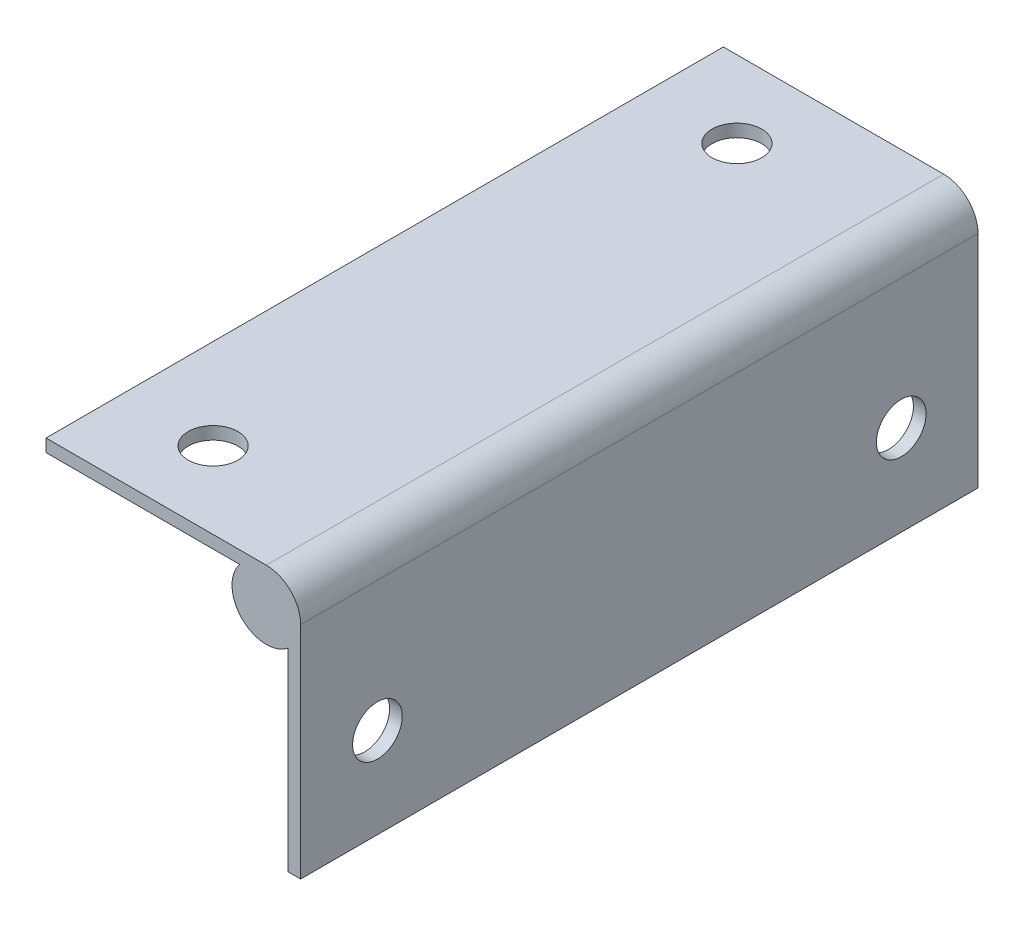
from build123d import *

# Parameters (mm, degrees)
EXTRUDE_1_DEPTH     = 75
SKETCH_2_R          = 2.75
CUT_EXTRUDE_1_DEPTH = 75


with BuildPart() as part:
    # 草图1 → 凸台-拉伸1 (new body)
    with BuildSketch(Plane.XY):
        with BuildLine():
            Line((-24.396183973, 2.4), (-2.946183973, 2.4))
            ThreePointArc((-2.946183973, 2.4), (-2.687005769, -2.687005769), (2.4, -2.946183973))
            Line((2.4, -2.946183973), (2.4, -24.396183973))
            Line((2.4, -24.396183973), (3.8, -24.396183973))
            Line((3.8, -24.396183973), (3.8, 0))
            ThreePointArc((3.8, 0), (2.687005769, 2.687005769), (0, 3.8))
            Line((0, 3.8), (-24.396183973, 3.8))
            Line((-24.396183973, 3.8), (-24.396183973, 2.4))
        make_face()
    extrude(amount=EXTRUDE_1_DEPTH)

    # 草图2 → 切除-拉伸1 (cut)
    with BuildSketch(Plane(origin=(0, 3.8, 0), x_dir=(1, 0, 0), z_dir=(0, 1, 0))):
        with Locations(Location((-14.396183973, -8.5, 0), (0, 0, 180))):
            Circle(SKETCH_2_R)
        with Locations(Location((-14.396183973, -66.5, 0), (0, 0, 180))):
            Circle(SKETCH_2_R)
    cut_extrude_1 = extrude(amount=-CUT_EXTRUDE_1_DEPTH, mode=Mode.SUBTRACT)

    # 镜向1: 切除-拉伸1 across plane
    add(cut_extrude_1.mirror(Plane(origin=(0, 0, 0), x_dir=(0, 0, 1), z_dir=(-0.7071067811865488, 0.7071067811865464, 0))), mode=Mode.SUBTRACT)


solid = part.part
